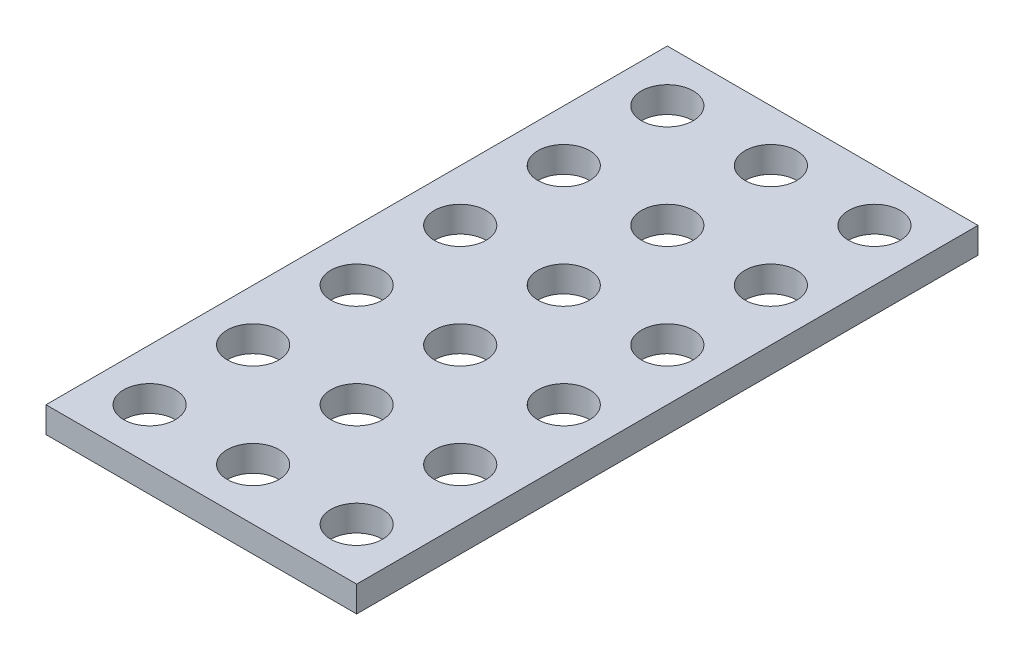
from build123d import *

# Parameters (mm, degrees)
SKETCH1_W            = 24
SKETCH1_H            = 48
BOSS_EXTRUDE1_DEPTH  = 2
SKETCH2_R            = 2
CUT_EXTRUDE1_DEPTH   = 2
LPATTERN1_COUNT      = 3
LPATTERN1_PITCH      = 8
LPATTERN1_COUNT_DIR2 = 6
LPATTERN1_PITCH_DIR2 = 8


with BuildPart() as part:
    # Sketch1 → Boss-Extrude1 (new body)
    with BuildSketch(Plane(origin=(0, 0, 0), x_dir=(1, 0, 0), z_dir=(0, 1, 0))):
        Rectangle(SKETCH1_W, SKETCH1_H)
    extrude(amount=BOSS_EXTRUDE1_DEPTH)

    # Sketch2 → Cut-Extrude1 (cut)
    with BuildSketch(Plane(origin=(0, 2, 0), x_dir=(1, 0, 0), z_dir=(0, 1, 0))):
        with Locations(Location((-8, 20, 0), (0, 0, 270))):
            Circle(SKETCH2_R)
    cut_extrude1 = extrude(amount=-CUT_EXTRUDE1_DEPTH, mode=Mode.SUBTRACT)

    # LPattern1: Cut-Extrude1 3 × 6
    with Locations(*[(i * LPATTERN1_PITCH, 0, j * LPATTERN1_PITCH_DIR2) for i in range(LPATTERN1_COUNT) for j in range(LPATTERN1_COUNT_DIR2) if (i, j) != (0, 0)]):
        add(cut_extrude1, mode=Mode.SUBTRACT)


solid = part.part
